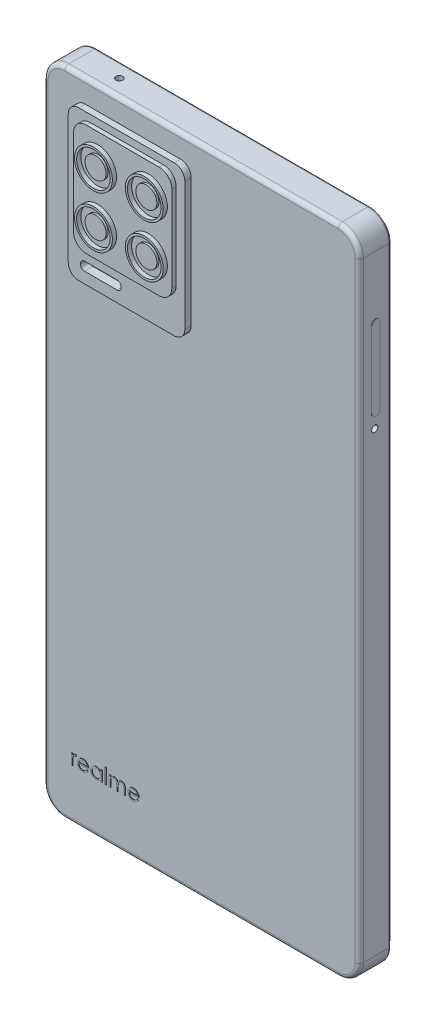
from build123d import *

# Parameters (mm, degrees)
BOSS_EXTRUDE1_DEPTH  = 7.5
BOSS_EXTRUDE3_DEPTH  = 1.5
BOSS_EXTRUDE5_DEPTH  = 1
CUT_EXTRUDE4_DEPTH   = 2
FILLET4_R            = 1
FILLET5_R            = 0.5
SKETCH5_R            = 4.5
SKETCH5_R_2          = 4
BOSS_EXTRUDE7_DEPTH  = 1
SKETCH6_R            = 2.5
BOSS_EXTRUDE8_DEPTH  = 0.5
BOSS_EXTRUDE10_DEPTH = 0.75
SKETCH8_R            = 2.5
CUT_EXTRUDE5_DEPTH   = 1
SKETCH9_R            = 1.8
BOSS_EXTRUDE11_DEPTH = 0.5
BOSS_EXTRUDE16_DEPTH = 0.75
SKETCH12_R           = 0.8
CUT_EXTRUDE7_DEPTH   = 8
CUT_EXTRUDE8_DEPTH   = 8
SKETCH15_W           = 7.919618757
SKETCH15_H           = 0.268242661
BOSS_EXTRUDE19_DEPTH = 7
SKETCH16_R           = 2
CUT_EXTRUDE9_DEPTH   = 7
SKETCH17_R           = 1
CUT_EXTRUDE10_DEPTH  = 7
CUT_EXTRUDE13_DEPTH  = 0.1
BOSS_EXTRUDE20_DEPTH = 0.1
SKETCH20_W           = 0.314102564
SKETCH20_H           = 3.58974359
BOSS_EXTRUDE21_DEPTH = 0.1
BOSS_EXTRUDE23_DEPTH = 0.05
SKETCH22_R           = 0.75
CUT_EXTRUDE15_DEPTH  = 7


with BuildPart() as part:
    # Sketch1 → Boss-Extrude1 (new body)
    with BuildSketch(Plane.XY):
        with BuildLine():
            Line((-14.166666667, 62.083333333), (50.833333333, 62.083333333))
            ThreePointArc((50.833333333, 62.083333333), (54.368867239, 60.618867239), (55.833333333, 57.083333333))
            Line((55.833333333, 57.083333333), (55.833333333, -87.916666667))
            ThreePointArc((55.833333333, -87.916666667), (54.368867239, -91.452200573), (50.833333333, -92.916666667))
            Line((50.833333333, -92.916666667), (-14.166666667, -92.916666667))
            ThreePointArc((-14.166666667, -92.916666667), (-17.702200573, -91.452200573), (-19.166666667, -87.916666667))
            Line((-19.166666667, -87.916666667), (-19.166666667, 57.083333333))
            ThreePointArc((-19.166666667, 57.083333333), (-17.702200573, 60.618867239), (-14.166666667, 62.083333333))
        make_face()
    extrude(amount=BOSS_EXTRUDE1_DEPTH)

    # Sketch2 → Boss-Extrude3 (add)
    with BuildSketch(Plane.XY.offset(7.5)):
        with BuildLine():
            Line((-9.342225207, 56.683333333), (13.357774793, 56.683333333))
            ThreePointArc((13.357774793, 56.683333333), (15.125541746, 55.951100286), (15.857774793, 54.183333333))
            Line((15.857774793, 54.183333333), (15.857774793, 23.583333333))
            ThreePointArc((15.857774793, 23.583333333), (15.125541746, 21.81556638), (13.357774793, 21.083333333))
            Line((13.357774793, 21.083333333), (-9.342225207, 21.083333333))
            ThreePointArc((-9.342225207, 21.083333333), (-11.10999216, 21.81556638), (-11.842225207, 23.583333333))
            Line((-11.842225207, 23.583333333), (-11.842225207, 54.183333333))
            ThreePointArc((-11.842225207, 54.183333333), (-11.10999216, 55.951100286), (-9.342225207, 56.683333333))
        make_face()
    extrude(amount=BOSS_EXTRUDE3_DEPTH)

    # Sketch3 → Boss-Extrude5 (add)
    with BuildSketch(Plane.XY.offset(9)):
        with BuildLine():
            Line((-6.575548555, 55.004495558), (10.774303424, 55.004495558))
            ThreePointArc((10.774303424, 55.004495558), (12.895623768, 54.125815902), (13.774303424, 52.004495558))
            Line((13.774303424, 52.004495558), (13.774303424, 31.53587849))
            ThreePointArc((13.774303424, 31.53587849), (12.895623768, 29.414558146), (10.774303424, 28.53587849))
            Line((10.774303424, 28.53587849), (-6.575548555, 28.53587849))
            ThreePointArc((-6.575548555, 28.53587849), (-8.696868898, 29.414558146), (-9.575548555, 31.53587849))
            Line((-9.575548555, 31.53587849), (-9.575548555, 52.004495558))
            ThreePointArc((-9.575548555, 52.004495558), (-8.696868898, 54.125815902), (-6.575548555, 55.004495558))
        make_face()
    extrude(amount=BOSS_EXTRUDE5_DEPTH)

    # Sketch4 → Cut-Extrude4 (cut)
    with BuildSketch(Plane.XY.offset(9)):
        with BuildLine():
            Line((-7.942225207, 25.781720126), (-0.24287533, 25.781720126))
            ThreePointArc((-0.24287533, 25.781720126), (0.464231451, 25.488826907), (0.75712467, 24.781720126))
            Line((0.75712467, 24.781720126), (0.75712467, 24.72141174))
            ThreePointArc((0.75712467, 24.72141174), (0.464231451, 24.014304959), (-0.24287533, 23.72141174))
            Line((-0.24287533, 23.72141174), (-7.942225207, 23.72141174))
            ThreePointArc((-7.942225207, 23.72141174), (-8.649331988, 24.014304959), (-8.942225207, 24.72141174))
            Line((-8.942225207, 24.72141174), (-8.942225207, 24.781720126))
            ThreePointArc((-8.942225207, 24.781720126), (-8.649331988, 25.488826907), (-7.942225207, 25.781720126))
        make_face()
    extrude(amount=-CUT_EXTRUDE4_DEPTH, mode=Mode.SUBTRACT)

    # Fillet4
    fillet4_edges = [part.edges().sort_by_distance(p)[0] for p in [
        (54.368867239, 60.618867239, 7.5),
        (18.333333333, 62.083333333, 7.5),
        (-17.702200573, 60.618867239, 7.5),
        (-19.166666667, -15.416666667, 7.5),
        (-17.702200573, -91.452200573, 7.5),
        (18.333333333, -92.916666667, 7.5),
        (54.368867239, -91.452200573, 7.5),
        (55.833333333, -15.416666667, 7.5),
    ]]
    fillet(fillet4_edges, radius=FILLET4_R)

    # Fillet5
    fillet5_edges = [part.edges().sort_by_distance(p)[0] for p in [
        (18.333333333, 62.083333333, 0),
        (54.368867239, 60.618867239, 0),
        (55.833333333, -15.416666667, 0),
        (54.368867239, -91.452200573, 0),
        (18.333333333, -92.916666667, 0),
        (-17.702200573, -91.452200573, 0),
        (-19.166666667, -15.416666667, 0),
        (-17.702200573, 60.618867239, 0),
    ]]
    fillet(fillet5_edges, radius=FILLET5_R)

    # Sketch5 → Boss-Extrude7 (add)
    # profile 1 of 4: a face of its own
    with BuildSketch(Plane.XY.offset(10)):
        with Locations((-3.85192843, 47.839398454)):
            Circle(SKETCH5_R)
        with Locations((-3.85192843, 47.839398454)):
            Circle(SKETCH5_R_2, mode=Mode.SUBTRACT)
    # profile 2 of 4: a face of its own
    with BuildSketch(Plane.XY.offset(10)):
        with Locations((-3.85192843, 35.581337572)):
            Circle(SKETCH5_R)
        with Locations((-3.85192843, 35.581337572)):
            Circle(SKETCH5_R_2, mode=Mode.SUBTRACT)
    # profile 3 of 4: a face of its own
    with BuildSketch(Plane.XY.offset(10)):
        with Locations((8.221534858, 35.581337572)):
            Circle(SKETCH5_R)
        with Locations((8.221534858, 35.581337572)):
            Circle(SKETCH5_R_2, mode=Mode.SUBTRACT)
    # profile 4 of 4: a face of its own
    with BuildSketch(Plane.XY.offset(10)):
        with Locations((8.221534858, 47.839398454)):
            Circle(SKETCH5_R)
        with Locations((8.221534858, 47.839398454)):
            Circle(SKETCH5_R_2, mode=Mode.SUBTRACT)
    extrude(amount=BOSS_EXTRUDE7_DEPTH)

    # Sketch6 → Boss-Extrude8 (add)
    with BuildSketch(Plane.XY.offset(10)):
        with Locations((-3.85192843, 47.839398454)):
            Circle(SKETCH6_R)
        with Locations((-3.85192843, 35.581337572)):
            Circle(SKETCH6_R)
        with Locations((8.221534858, 35.581337572)):
            Circle(SKETCH6_R)
        with Locations((8.221534858, 47.839398454)):
            Circle(SKETCH6_R)
    extrude(amount=BOSS_EXTRUDE8_DEPTH)

    # Sketch7 → Boss-Extrude10 (add)
    with BuildSketch(Plane(origin=(0, 0, 0), x_dir=(-1, 0, 0), z_dir=(0, 0, -1))):
        with BuildLine():
            Line((-50.833333333, 60.583333333), (14.166666667, 60.583333333))
            ThreePointArc((14.166666667, 60.583333333), (16.995093791, 59.411760458), (18.166666667, 56.583333333))
            Line((18.166666667, 56.583333333), (18.166666667, -87.416666667))
            ThreePointArc((18.166666667, -87.416666667), (16.995093791, -90.245093791), (14.166666667, -91.416666667))
            Line((14.166666667, -91.416666667), (-50.833333333, -91.416666667))
            ThreePointArc((-50.833333333, -91.416666667), (-53.661760458, -90.245093791), (-54.833333333, -87.416666667))
            Line((-54.833333333, -87.416666667), (-54.833333333, 56.583333333))
            ThreePointArc((-54.833333333, 56.583333333), (-53.661760458, 59.411760458), (-50.833333333, 60.583333333))
        make_face()
    extrude(amount=BOSS_EXTRUDE10_DEPTH)

    # Sketch8 → Cut-Extrude5 (cut)
    with BuildSketch(Plane(origin=(0, 0, -0.75), x_dir=(-1, 0, 0), z_dir=(0, 0, -1))):
        with Locations((-50.083333333, 55.618855431)):
            Circle(SKETCH8_R)
    extrude(amount=-CUT_EXTRUDE5_DEPTH, mode=Mode.SUBTRACT)

    # Sketch9 → Boss-Extrude11 (add)
    with BuildSketch(Plane(origin=(0, 0, 0.25), x_dir=(-1, 0, 0), z_dir=(0, 0, -1))):
        with Locations((-50.083333333, 55.618855431)):
            Circle(SKETCH9_R)
    extrude(amount=BOSS_EXTRUDE11_DEPTH)

    # Sketch10 → Boss-Extrude16 (add)
    with BuildSketch(Plane.ZY.offset(19.166666667)):
        with BuildLine():
            Line((4.896629232, 20.083333333), (4.896629232, 0.083333333))
            ThreePointArc((4.896629232, 0.083333333), (3.679261729, -1.13403417), (2.461894226, 0.083333333))
            Line((2.461894226, 0.083333333), (2.461894226, 20.083333333))
            ThreePointArc((2.461894226, 20.083333333), (3.679261729, 21.300700836), (4.896629232, 20.083333333))
        make_face()
        with BuildLine():
            Line((5.021365114, -8.167632772), (5.021365114, -19.167632772))
            ThreePointArc((5.021365114, -19.167632772), (3.679261729, -20.509736157), (2.337158343, -19.167632772))
            Line((2.337158343, -19.167632772), (2.337158343, -8.167632772))
            ThreePointArc((2.337158343, -8.167632772), (3.679261729, -6.825529387), (5.021365114, -8.167632772))
        make_face()
    extrude(amount=BOSS_EXTRUDE16_DEPTH)

    # Sketch12 → Cut-Extrude7 (cut)
    with BuildSketch(Plane(origin=(0, 62.083333333, 0), x_dir=(1, 0, 0), z_dir=(0, 1, 0))):
        with Locations(Location((-5.18973606, -3.5, 0), (0, 0, 270))):
            Circle(SKETCH12_R)
    extrude(amount=-CUT_EXTRUDE7_DEPTH, mode=Mode.SUBTRACT)

    # Sketch13 → Cut-Extrude8 (cut)
    with BuildSketch(Plane.XZ.offset(92.916666667)):
        with BuildLine():
            Line((15.333333333, 4.796928262), (24.333333333, 4.796928262))
            ThreePointArc((24.333333333, 4.796928262), (25.770853159, 3.359408436), (24.333333333, 1.92188861))
            Line((24.333333333, 1.92188861), (15.333333333, 1.92188861))
            ThreePointArc((15.333333333, 1.92188861), (13.895813507, 3.359408436), (15.333333333, 4.796928262))
        make_face()
    extrude(amount=-CUT_EXTRUDE8_DEPTH, mode=Mode.SUBTRACT)

    # Sketch15 → Boss-Extrude19 (add)
    with BuildSketch(Plane(origin=(0, -84.916666667, 0), x_dir=(-1, 0, 0), z_dir=(0, -1, 0))):
        with Locations((-19.830198847, -3.057664973)):
            Rectangle(SKETCH15_W, SKETCH15_H)
    extrude(amount=BOSS_EXTRUDE19_DEPTH)

    # Sketch16 → Cut-Extrude9 (cut)
    with BuildSketch(Plane(origin=(0, -92.916666667, 0), x_dir=(-1, 0, 0), z_dir=(0, -1, 0))):
        with Locations(Location((-45.899249036, -3.305574032, 0), (0, 0, 180))):
            Circle(SKETCH16_R)
    extrude(amount=-CUT_EXTRUDE9_DEPTH, mode=Mode.SUBTRACT)

    # Sketch17 → Cut-Extrude10 (cut)
    with BuildSketch(Plane.XZ.offset(92.916666667)):
        with Locations((-11.270024957, 3.533806432)):
            Circle(SKETCH17_R)
        with Locations((-8.270024957, 3.533806432)):
            Circle(SKETCH17_R)
        with Locations((-5.270024957, 3.533806432)):
            Circle(SKETCH17_R)
        with Locations((-2.270024957, 3.533806432)):
            Circle(SKETCH17_R)
        with Locations((0.729975043, 3.533806432)):
            Circle(SKETCH17_R)
        with Locations((31.85454908, 3.533806432)):
            Circle(SKETCH17_R)
        with Locations((34.85454908, 3.533806432)):
            Circle(SKETCH17_R)
    extrude(amount=-CUT_EXTRUDE10_DEPTH, mode=Mode.SUBTRACT)

    # Sketch18 → Cut-Extrude13 (cut)
    with BuildSketch(Plane(origin=(0, 0, -0.75), x_dir=(-1, 0, 0), z_dir=(0, 0, -1))):
        with BuildLine():
            Line((-27.833333333, 62.583333333), (-9.833333333, 62.583333333))
            ThreePointArc((-9.833333333, 62.583333333), (-7.833333333, 60.583333333), (-9.833333333, 58.583333333))
            Line((-9.833333333, 58.583333333), (-27.833333333, 58.583333333))
            ThreePointArc((-27.833333333, 58.583333333), (-29.833333333, 60.583333333), (-27.833333333, 62.583333333))
        make_face()
    extrude(amount=-CUT_EXTRUDE13_DEPTH, mode=Mode.SUBTRACT)

    # Sketch19 → Boss-Extrude20 (add)
    with BuildSketch(Plane(origin=(0, 0, -0.65), x_dir=(-1, 0, 0), z_dir=(0, 0, -1))):
        with BuildLine():
            Line((-27.652037886, 59.565095544), (-9.435764329, 59.565095544))
            ThreePointArc((-9.435764329, 59.565095544), (-9.365053651, 59.535806222), (-9.335764329, 59.465095544))
            Line((-9.335764329, 59.465095544), (-9.335764329, 59.269119771))
            ThreePointArc((-9.335764329, 59.269119771), (-9.365053651, 59.198409093), (-9.435764329, 59.169119771))
            Line((-9.435764329, 59.169119771), (-27.652037886, 59.169119771))
            ThreePointArc((-27.652037886, 59.169119771), (-27.722748564, 59.198409093), (-27.752037886, 59.269119771))
            Line((-27.752037886, 59.269119771), (-27.752037886, 59.465095544))
            ThreePointArc((-27.752037886, 59.465095544), (-27.722748564, 59.535806222), (-27.652037886, 59.565095544))
        make_face()
    extrude(amount=BOSS_EXTRUDE20_DEPTH)

    # Sketch20 → Boss-Extrude21 (add)
    # profile 1 of 6: a face of its own
    with BuildSketch(Plane.XY.offset(7.5)):
        with BuildLine():
            Line((-12.515569092, -78.364452134), (-12.201466528, -78.364452134))
            Line((-12.201466528, -78.364452134), (-12.201466528, -78.740954538))
            add(Edge.make_bspline(
                [(-12.201466528, -78.740954538), (-12.178277769, -78.70589871), (-12.133929448, -78.638854711), (-12.060216519, -78.55018541), (-11.984713188, -78.476770363), (-11.907058, -78.418266844), (-11.8266799, -78.374453725), (-11.745342949, -78.34236069), (-11.661767479, -78.323383375), (-11.605605555, -78.320849716), (-11.577468131, -78.31958034)],
                knots=[0, 0, 0, 0, 1.2804753, 2.448899062, 3.506932113, 4.484331642, 5.4025378, 6.288909075, 7.142734305, 8, 8, 8, 8], degree=3))
            add(Edge.make_bspline(
                [(-11.577468131, -78.31958034), (-11.555641804, -78.320770866), (-11.510732719, -78.323220452), (-11.442750129, -78.340431277), (-11.372706677, -78.367909299), (-11.32756429, -78.393749522), (-11.304030631, -78.407220564)],
                knots=[0, 0, 0, 0, 0.901110191, 1.854092781, 2.881294221, 4, 4, 4, 4], degree=3))
            Line((-11.304030631, -78.407220564), (-11.476506592, -78.67925582))
            add(Edge.make_bspline(
                [(-11.476506592, -78.67925582), (-11.491615613, -78.672515554), (-11.520295428, -78.659721239), (-11.562249994, -78.644579229), (-11.600931331, -78.635663313), (-11.625574889, -78.634312595), (-11.637063483, -78.633682904)],
                knots=[0, 0, 0, 0, 1.180555205, 2.24091978, 3.179933427, 4, 4, 4, 4], degree=3))
            add(Edge.make_bspline(
                [(-11.637063483, -78.633682904), (-11.662269217, -78.635362941), (-11.713681607, -78.63878973), (-11.789166106, -78.665728538), (-11.862413311, -78.709253778), (-11.920584974, -78.75752489), (-11.965627227, -78.804072687), (-11.997767452, -78.84472109), (-12.027250199, -78.890299722), (-12.05542042, -78.940029405), (-12.081086714, -78.994759251), (-12.105041383, -79.053942465), (-12.126700246, -79.117647594), (-12.13905049, -79.162030114), (-12.145376784, -79.184764634)],
                knots=[0, 0, 0, 0, 1.125678352, 2.296057538, 3.5422874, 4.923748041, 5.663163013, 6.437101912, 7.23742474, 8.08941207, 8.991984279, 9.93940061, 10.944477711, 12, 12, 12, 12], degree=3))
            add(Edge.make_bspline(
                [(-12.145376784, -79.184764634), (-12.150109178, -79.205041808), (-12.160591069, -79.249954207), (-12.170782607, -79.325302731), (-12.180852125, -79.41432639), (-12.187948744, -79.517272983), (-12.194526786, -79.633885427), (-12.198236868, -79.764341373), (-12.201340009, -79.908774724), (-12.201423075, -80.009749077), (-12.201466528, -80.062569122)],
                knots=[0, 0, 0, 0, 0.566838948, 1.255505196, 2.06880316, 3.007127437, 4.065329342, 5.249902469, 6.561414163, 8, 8, 8, 8], degree=3))
            Line((-12.201466528, -80.062569122), (-12.201466528, -80.922144442))
            Line((-12.201466528, -80.922144442), (-12.515569092, -80.922144442))
            Line((-12.515569092, -80.922144442), (-12.515569092, -78.364452134))
        make_face()
    # profile 2 of 6: a face of its own
    with BuildSketch(Plane.XY.offset(7.5)):
        with BuildLine():
            Line((-8.890769413, -80.114452134), (-8.611722938, -80.26098659))
            add(Edge.make_bspline(
                [(-8.611722938, -80.26098659), (-8.633959533, -80.300429921), (-8.677223142, -80.377171024), (-8.75162389, -80.482602884), (-8.829615962, -80.5774506), (-8.91471993, -80.659180254), (-9.004389609, -80.730431639), (-9.099122264, -80.792769464), (-9.199411082, -80.845887984), (-9.305260807, -80.890640512), (-9.417560358, -80.925050006), (-9.536581874, -80.949354227), (-9.66255337, -80.964377496), (-9.748899549, -80.966122637), (-9.793113163, -80.967016237)],
                knots=[0, 0, 0, 0, 1.120438281, 2.179929193, 3.190490725, 4.156257408, 5.095198341, 6.022838206, 6.959905092, 7.901321166, 8.864066838, 9.862729781, 10.905609505, 12, 12, 12, 12], degree=3))
            add(Edge.make_bspline(
                [(-9.793113163, -80.967016237), (-9.84225514, -80.965869062), (-9.938116902, -80.963631255), (-10.077656649, -80.94433879), (-10.209036067, -80.912866432), (-10.332247771, -80.86890089), (-10.446990023, -80.811473566), (-10.553490878, -80.741514084), (-10.652310404, -80.65938183), (-10.740334613, -80.564365386), (-10.819578496, -80.462683429), (-10.889504316, -80.356727544), (-10.947961747, -80.24676432), (-10.995514357, -80.133493796), (-11.033919222, -80.017629902), (-11.060685926, -79.898118435), (-11.076115674, -79.775282851), (-11.078480119, -79.692185515), (-11.079671656, -79.650309506)],
                knots=[0, 0, 0, 0, 1.145258523, 2.234067595, 3.276747158, 4.290159414, 5.277019952, 6.260822364, 7.254936242, 8.264827045, 9.274100331, 10.257902744, 11.220704747, 12.172965371, 13.118907548, 14.062713208, 15.023725156, 16, 16, 16, 16], degree=3))
            add(Edge.make_bspline(
                [(-11.079671656, -79.650309506), (-11.078612515, -79.611014676), (-11.076513437, -79.533137511), (-11.063282649, -79.417871967), (-11.039834356, -79.305843514), (-11.007658032, -79.196959066), (-10.966106786, -79.091400932), (-10.915274567, -78.989104868), (-10.855082189, -78.890179729), (-10.808609515, -78.827776595), (-10.785200502, -78.79634316)],
                knots=[0, 0, 0, 0, 1.024358464, 2.0301432, 3.019427413, 4.004406732, 4.986367066, 5.972626655, 6.978780325, 8, 8, 8, 8], degree=3))
            add(Edge.make_bspline(
                [(-10.785200502, -78.79634316), (-10.75349282, -78.75847429), (-10.691081873, -78.68393614), (-10.585525518, -78.585997814), (-10.471225321, -78.503954039), (-10.349613695, -78.435946902), (-10.219277221, -78.384273255), (-10.08196793, -78.345765673), (-9.936122344, -78.324187662), (-9.836417123, -78.321139829), (-9.785400823, -78.31958034)],
                knots=[0, 0, 0, 0, 1.030682036, 2.02871468, 2.997146059, 3.962720338, 4.930598197, 5.918074684, 6.934738563, 8, 8, 8, 8], degree=3))
            add(Edge.make_bspline(
                [(-9.785400823, -78.31958034), (-9.732953218, -78.320934388), (-9.630062972, -78.323590724), (-9.480030851, -78.348217057), (-9.338070134, -78.387269612), (-9.20423763, -78.442423402), (-9.078519769, -78.513582954), (-8.961733719, -78.601724795), (-8.851882207, -78.704142883), (-8.787973628, -78.782906092), (-8.755452906, -78.822985788)],
                knots=[0, 0, 0, 0, 1.056321875, 2.072262726, 3.055038591, 4.01806755, 4.982017516, 5.957941055, 6.960871419, 8, 8, 8, 8], degree=3))
            add(Edge.make_bspline(
                [(-8.755452906, -78.822985788), (-8.733325968, -78.85318937), (-8.689219375, -78.913395488), (-8.633972275, -79.011566645), (-8.58601488, -79.11427724), (-8.547681919, -79.223187537), (-8.516642418, -79.337007117), (-8.494185599, -79.456549662), (-8.48101598, -79.581779573), (-8.478427283, -79.667106129), (-8.477107554, -79.710605981)],
                knots=[0, 0, 0, 0, 0.94817472, 1.890038105, 2.849395472, 3.817997239, 4.812318967, 5.836947057, 6.897266129, 8, 8, 8, 8], degree=3))
            Line((-8.477107554, -79.710605981), (-10.765569092, -79.710605981))
            add(Edge.make_bspline(
                [(-10.765569092, -79.710605981), (-10.764029486, -79.744306445), (-10.761001912, -79.810577049), (-10.746886769, -79.907547832), (-10.724637995, -79.999921174), (-10.693368932, -80.087004216), (-10.655502087, -80.169934343), (-10.60911637, -80.24809638), (-10.553776816, -80.32113431), (-10.492051117, -80.389701448), (-10.423344021, -80.450762209), (-10.351061274, -80.505413985), (-10.274167709, -80.551219582), (-10.193269626, -80.588399472), (-10.108497841, -80.617505788), (-10.019825645, -80.637373609), (-9.927427529, -80.650680715), (-9.864441795, -80.652160381), (-9.832375983, -80.652913673)],
                knots=[0, 0, 0, 0, 1.094153842, 2.151609401, 3.174256925, 4.172055639, 5.149267565, 6.128595816, 7.11444997, 8.118368179, 9.117203808, 10.09244225, 11.054858984, 12.015122123, 12.976791628, 13.957293641, 14.960065497, 16, 16, 16, 16], degree=3))
            add(Edge.make_bspline(
                [(-9.832375983, -80.652913673), (-9.801024835, -80.652305616), (-9.738818145, -80.651099115), (-9.646177287, -80.639367204), (-9.55503776, -80.620396929), (-9.465776777, -80.594506939), (-9.380205931, -80.562930086), (-9.300960381, -80.524827229), (-9.228080165, -80.482677482), (-9.159963198, -80.434467807), (-9.093892205, -80.37545962), (-9.028349719, -80.301823899), (-8.958073065, -80.214736371), (-8.914083472, -80.149190705), (-8.890769413, -80.114452134)],
                knots=[0, 0, 0, 0, 0.99110716, 1.966546729, 2.947904876, 3.932708344, 4.903319531, 5.828989031, 6.710028674, 7.56322171, 8.463672341, 9.504779593, 10.677557249, 12, 12, 12, 12], degree=3))
        make_face()
        with BuildLine():
            add(Edge.make_bspline(
                [(-8.791210118, -79.396503416), (-8.802706742, -79.354840543), (-8.824834044, -79.274652922), (-8.871070408, -79.163612032), (-8.923141949, -79.064924131), (-8.98476368, -78.979344498), (-9.054582406, -78.903340985), (-9.135227589, -78.836922399), (-9.225663482, -78.777504948), (-9.325422623, -78.727352449), (-9.431064408, -78.68466259), (-9.5416706, -78.656037474), (-9.654528388, -78.636427932), (-9.730862674, -78.634601824), (-9.769275022, -78.633682904)],
                knots=[0, 0, 0, 0, 1.154881502, 2.222775134, 3.210006277, 4.132804581, 5.035138423, 5.962687519, 6.919655026, 7.923214229, 8.944639381, 9.960483929, 10.97369054, 12, 12, 12, 12], degree=3))
            add(Edge.make_bspline(
                [(-9.769275022, -78.633682904), (-9.80062446, -78.634294575), (-9.862595709, -78.635503721), (-9.953896777, -78.646973851), (-10.041576476, -78.665933695), (-10.126281764, -78.691898652), (-10.206902632, -78.726507255), (-10.2850974, -78.767090481), (-10.358877797, -78.816632065), (-10.405019092, -78.85439092), (-10.428329509, -78.873466557)],
                knots=[0, 0, 0, 0, 1.04873581, 2.073130211, 3.073294108, 4.04793562, 5.032784715, 6.005352987, 6.992311501, 8, 8, 8, 8], degree=3))
            add(Edge.make_bspline(
                [(-10.428329509, -78.873466557), (-10.445022791, -78.888560873), (-10.478805925, -78.919108089), (-10.523946446, -78.971737296), (-10.567166919, -79.028488858), (-10.606500572, -79.091533982), (-10.642578158, -79.160154761), (-10.676338135, -79.233772397), (-10.706724548, -79.312945527), (-10.723820658, -79.368117966), (-10.732616368, -79.396503416)],
                knots=[0, 0, 0, 0, 0.879870761, 1.780643979, 2.707998968, 3.669668524, 4.684282772, 5.740141944, 6.837334558, 8, 8, 8, 8], degree=3))
            Line((-10.732616368, -79.396503416), (-8.791210118, -79.396503416))
        make_face(mode=Mode.SUBTRACT)
    # profile 3 of 6: a face of its own
    with BuildSketch(Plane.XY.offset(7.5)):
        with BuildLine():
            Line((-5.246338323, -78.364452134), (-5.246338323, -80.922144442))
            Line((-5.246338323, -80.922144442), (-5.560440887, -80.922144442))
            Line((-5.560440887, -80.922144442), (-5.560440887, -80.47973659))
            add(Edge.make_bspline(
                [(-5.560440887, -80.47973659), (-5.595859678, -80.519776183), (-5.664979893, -80.597913955), (-5.780421011, -80.699996127), (-5.902789189, -80.784374449), (-6.03149051, -80.852524364), (-6.166408753, -80.903716421), (-6.30724484, -80.94010258), (-6.454056221, -80.963496415), (-6.554308576, -80.965832437), (-6.605112361, -80.967016237)],
                knots=[0, 0, 0, 0, 1.074387032, 2.096679803, 3.090159297, 4.057316773, 5.018401886, 5.985159533, 6.978961417, 8, 8, 8, 8], degree=3))
            add(Edge.make_bspline(
                [(-6.605112361, -80.967016237), (-6.650280315, -80.965789865), (-6.73935352, -80.963371404), (-6.870382597, -80.944609101), (-6.996474847, -80.914478479), (-7.117749419, -80.87257759), (-7.233421565, -80.816996768), (-7.344481661, -80.75045552), (-7.450354353, -80.67121469), (-7.549425892, -80.580626661), (-7.640657893, -80.482231674), (-7.720719165, -80.377286127), (-7.787472245, -80.266243823), (-7.843292326, -80.15051067), (-7.88628867, -80.02919575), (-7.916262305, -79.902718582), (-7.935002751, -79.771228709), (-7.937420212, -79.681689185), (-7.938646015, -79.63628707)],
                knots=[0, 0, 0, 0, 1.033919861, 2.038935746, 3.024066025, 3.998881131, 4.97069526, 5.957263378, 6.95902576, 7.993208707, 9.027059324, 10.027763471, 11.009749337, 11.988697705, 12.965288445, 13.950418724, 14.960734635, 16, 16, 16, 16], degree=3))
            add(Edge.make_bspline(
                [(-7.938646015, -79.63628707), (-7.937393044, -79.591823367), (-7.934915987, -79.503921023), (-7.916462767, -79.374642325), (-7.885431758, -79.250124065), (-7.841883911, -79.130767121), (-7.786041956, -79.016427071), (-7.718113869, -78.907023046), (-7.638094744, -78.802253649), (-7.545842337, -78.704582422), (-7.445907567, -78.614361808), (-7.338998836, -78.535952762), (-7.227775555, -78.468235913), (-7.110512544, -78.414582437), (-6.988945439, -78.371173333), (-6.861991994, -78.341140365), (-6.730180415, -78.323443043), (-6.640689923, -78.320880279), (-6.595296656, -78.31958034)],
                knots=[0, 0, 0, 0, 1.020392517, 2.01726096, 2.990465484, 3.961182959, 4.928053699, 5.906110375, 6.912531644, 7.948652711, 8.985773172, 9.998621852, 10.987621588, 11.969261332, 12.953316658, 13.946091881, 14.958173133, 16, 16, 16, 16], degree=3))
            add(Edge.make_bspline(
                [(-6.595296656, -78.31958034), (-6.543096797, -78.321018091), (-6.440735337, -78.323837454), (-6.291007328, -78.347300181), (-6.14936285, -78.386938648), (-6.014708498, -78.440856146), (-5.887527812, -78.512504876), (-5.769024828, -78.602884837), (-5.657959344, -78.711426024), (-5.593579053, -78.794796468), (-5.560440887, -78.837709346)],
                knots=[0, 0, 0, 0, 1.038897134, 2.037228247, 3.008116434, 3.962042015, 4.918381754, 5.904844433, 6.921570401, 8, 8, 8, 8], degree=3))
            Line((-5.560440887, -78.837709346), (-5.560440887, -78.364452134))
            Line((-5.560440887, -78.364452134), (-5.246338323, -78.364452134))
        make_face()
        with BuildLine():
            add(Edge.make_bspline(
                [(-6.591089925, -78.633682904), (-6.637004263, -78.635316541), (-6.727631863, -78.638541082), (-6.860675865, -78.663714578), (-6.987989279, -78.705599172), (-7.108935354, -78.762881073), (-7.22160357, -78.83490981), (-7.322297241, -78.922031193), (-7.411839942, -79.021868207), (-7.487148207, -79.133970318), (-7.548538704, -79.254148409), (-7.591705736, -79.379772847), (-7.620174983, -79.508577824), (-7.623083504, -79.59594051), (-7.624543451, -79.639792679)],
                knots=[0, 0, 0, 0, 1.031046209, 2.035121221, 3.029706178, 4.034933723, 5.034054252, 6.02443088, 7.017295772, 8.038157696, 9.050218397, 10.03989886, 11.016116709, 12, 12, 12, 12], degree=3))
            add(Edge.make_bspline(
                [(-7.624543451, -79.639792679), (-7.622678558, -79.683382786), (-7.618956081, -79.770392142), (-7.592205386, -79.899372719), (-7.547325513, -80.025026761), (-7.48608345, -80.146287755), (-7.409396826, -80.258871855), (-7.320508173, -80.360611978), (-7.218557892, -80.448101566), (-7.105630385, -80.521339139), (-6.985022414, -80.58050166), (-6.858188483, -80.6216673), (-6.727512845, -80.64824508), (-6.638660511, -80.651349557), (-6.593894413, -80.652913673)],
                knots=[0, 0, 0, 0, 0.979072187, 1.954306742, 2.945804271, 3.96968567, 4.997920485, 5.998718438, 6.996577872, 8.005894225, 9.015743152, 10.005417472, 10.995077863, 12, 12, 12, 12], degree=3))
            add(Edge.make_bspline(
                [(-6.593894413, -80.652913673), (-6.54844791, -80.651253709), (-6.458059323, -80.647952205), (-6.324620615, -80.62267094), (-6.195125653, -80.580902142), (-6.071338424, -80.523003015), (-5.956022293, -80.451245659), (-5.852524415, -80.367238568), (-5.765008447, -80.269535384), (-5.690815838, -80.162158931), (-5.632640421, -80.044446934), (-5.590264362, -79.919112744), (-5.565210456, -79.786151996), (-5.562052726, -79.695288069), (-5.560440887, -79.648907263)],
                knots=[0, 0, 0, 0, 1.01762866, 2.023962475, 3.030623092, 4.058876274, 5.077231937, 6.066672613, 7.034107872, 8.005628644, 8.981990164, 9.965428785, 10.961468474, 12, 12, 12, 12], degree=3))
            add(Edge.make_bspline(
                [(-5.560440887, -79.648907263), (-5.561400543, -79.613569432), (-5.563289451, -79.544013399), (-5.57772002, -79.441885881), (-5.600674947, -79.344152155), (-5.633021117, -79.250709466), (-5.675512401, -79.162074451), (-5.726760167, -79.07761069), (-5.787665617, -78.997757479), (-5.857248313, -78.923614408), (-5.933413515, -78.855987946), (-6.014008056, -78.795623705), (-6.099986803, -78.746034932), (-6.18990384, -78.704993661), (-6.283915174, -78.672334511), (-6.382785794, -78.650546817), (-6.485464781, -78.635586496), (-6.555510836, -78.634324115), (-6.591089925, -78.633682904)],
                knots=[0, 0, 0, 0, 1.050140795, 2.067009409, 3.05949893, 4.030605086, 5.00011959, 5.97591094, 6.962425594, 7.979863591, 8.993523472, 9.986985069, 10.967611495, 11.937549037, 12.921786183, 13.919465291, 14.943216303, 16, 16, 16, 16], degree=3))
        make_face(mode=Mode.SUBTRACT)
    # profile 4 of 6: a face of its own
    with BuildSketch(Plane.XY.offset(7.5)):
        with Locations((-4.416210118, -79.127272647)):
            Rectangle(SKETCH20_W, SKETCH20_H)
    # profile 5 of 6: a face of its own
    with BuildSketch(Plane.XY.offset(7.5)):
        with BuildLine():
            Line((-3.541210118, -78.364452134), (-3.227107554, -78.364452134))
            Line((-3.227107554, -78.364452134), (-3.227107554, -78.808963352))
            add(Edge.make_bspline(
                [(-3.227107554, -78.808963352), (-3.198823604, -78.770075751), (-3.144628844, -78.695563378), (-3.055763192, -78.597373093), (-2.966987079, -78.514044939), (-2.903053697, -78.470302067), (-2.872339925, -78.449287872)],
                knots=[0, 0, 0, 0, 1.134379233, 2.173579362, 3.122582517, 4, 4, 4, 4], degree=3))
            add(Edge.make_bspline(
                [(-2.872339925, -78.449287872), (-2.830475263, -78.429282506), (-2.747477363, -78.389621293), (-2.616058139, -78.349387734), (-2.481583469, -78.324662633), (-2.390775255, -78.321281259), (-2.345096336, -78.31958034)],
                knots=[0, 0, 0, 0, 1.014936303, 2.012140481, 3.000054389, 4, 4, 4, 4], degree=3))
            add(Edge.make_bspline(
                [(-2.345096336, -78.31958034), (-2.314203339, -78.32062563), (-2.25306776, -78.322694205), (-2.16248367, -78.33615424), (-2.074625058, -78.359420413), (-1.990011029, -78.391827737), (-1.91029035, -78.431074424), (-1.837201152, -78.477124132), (-1.771576944, -78.528821207), (-1.713450892, -78.58850014), (-1.661181867, -78.657836738), (-1.61310302, -78.738700987), (-1.568677808, -78.832908648), (-1.544056499, -78.901275189), (-1.531093932, -78.937268641)],
                knots=[0, 0, 0, 0, 1.009824226, 1.998387844, 2.986035974, 3.974953746, 4.955485308, 5.885931332, 6.793869504, 7.679848016, 8.601185859, 9.625726857, 10.749998409, 12, 12, 12, 12], degree=3))
            add(Edge.make_bspline(
                [(-1.531093932, -78.937268641), (-1.51738268, -78.912544222), (-1.490400863, -78.863890037), (-1.445095226, -78.795031774), (-1.39762743, -78.730624982), (-1.347592937, -78.670618558), (-1.29516835, -78.615308828), (-1.24010695, -78.564512926), (-1.182722168, -78.518012712), (-1.102929928, -78.463689553), (-0.999117321, -78.405988371), (-0.868229206, -78.355959927), (-0.732079035, -78.325043799), (-0.639661336, -78.321413526), (-0.59299297, -78.31958034)],
                knots=[0, 0, 0, 0, 0.86119277, 1.694706429, 2.50939023, 3.298075842, 4.073795165, 4.829715201, 5.57930267, 6.321991688, 7.768977793, 9.186738141, 10.579381044, 12, 12, 12, 12], degree=3))
            add(Edge.make_bspline(
                [(-0.59299297, -78.31958034), (-0.550111507, -78.32119756), (-0.466188321, -78.324362619), (-0.344011055, -78.349216092), (-0.23006925, -78.391893739), (-0.124592174, -78.450127376), (-0.029432361, -78.523306559), (0.053283949, -78.610375397), (0.123054312, -78.71071802), (0.168632952, -78.805110008), (0.199548216, -78.888445341), (0.21860945, -78.959451632), (0.235449145, -79.037603185), (0.249430391, -79.122993447), (0.259648943, -79.215924055), (0.267219658, -79.316242931), (0.272343732, -79.424028043), (0.272705804, -79.498393543), (0.272892446, -79.536727775)],
                knots=[0, 0, 0, 0, 1.209669288, 2.367440248, 3.500751976, 4.631527125, 5.755587489, 6.87532382, 8.007944318, 9.190864318, 9.82315674, 10.514484317, 11.263564316, 12.079023757, 12.955305781, 13.901327259, 14.918167583, 16, 16, 16, 16], degree=3))
            Line((0.272892446, -79.536727775), (0.272892446, -80.922144442))
            Line((0.272892446, -80.922144442), (-0.041210118, -80.922144442))
            Line((-0.041210118, -80.922144442), (-0.041210118, -79.535325532))
            add(Edge.make_bspline(
                [(-0.041210118, -79.535325532), (-0.041288001, -79.502604958), (-0.04143768, -79.439720991), (-0.044131311, -79.34946854), (-0.049206626, -79.267200183), (-0.055141264, -79.193028094), (-0.063385074, -79.126779306), (-0.074031005, -79.068586887), (-0.085308685, -79.017993076), (-0.104044676, -78.961907028), (-0.133992568, -78.900036818), (-0.179610048, -78.833313242), (-0.237080154, -78.775232442), (-0.303440311, -78.724814125), (-0.378988756, -78.683820484), (-0.462253479, -78.654544474), (-0.55271753, -78.636421596), (-0.615340319, -78.63461558), (-0.64768047, -78.633682904)],
                knots=[0, 0, 0, 0, 1.253487763, 2.409012846, 3.458416907, 4.410876679, 5.259312806, 6.014470957, 6.676830364, 7.243083969, 8.276244668, 9.299465089, 10.325150304, 11.392391894, 12.482080715, 13.603491619, 14.762376348, 16, 16, 16, 16], degree=3))
            add(Edge.make_bspline(
                [(-0.64768047, -78.633682904), (-0.687350425, -78.635099061), (-0.765753336, -78.637897926), (-0.880198822, -78.666471799), (-0.990169839, -78.70955205), (-1.092384972, -78.771984507), (-1.186412762, -78.846792871), (-1.26731234, -78.935742467), (-1.334144526, -79.036372394), (-1.379398502, -79.129519096), (-1.407987803, -79.21318854), (-1.426864719, -79.286285912), (-1.44154811, -79.36936748), (-1.455318639, -79.461874971), (-1.464306367, -79.564445151), (-1.47247474, -79.676603552), (-1.476295602, -79.798687511), (-1.476830061, -79.8833142), (-1.477107554, -79.927252615)],
                knots=[0, 0, 0, 0, 1.090531906, 2.155305635, 3.229839962, 4.33261226, 5.44038871, 6.529323825, 7.629011124, 8.757537029, 9.370236727, 10.061839251, 10.834451254, 11.692844982, 12.636905849, 13.66920014, 14.789842145, 16, 16, 16, 16], degree=3))
            Line((-1.477107554, -79.927252615), (-1.477107554, -80.922144442))
            Line((-1.477107554, -80.922144442), (-1.791210118, -80.922144442))
            Line((-1.791210118, -80.922144442), (-1.791210118, -79.621563513))
            add(Edge.make_bspline(
                [(-1.791210118, -79.621563513), (-1.791289549, -79.584870194), (-1.791442366, -79.514275937), (-1.794118683, -79.413042261), (-1.799205305, -79.320961181), (-1.805085853, -79.238139717), (-1.813546032, -79.164728389), (-1.823155794, -79.100333631), (-1.834504404, -79.04511688), (-1.853294289, -78.984553495), (-1.882008757, -78.917832572), (-1.928197019, -78.846691551), (-1.9858046, -78.784423453), (-2.053375476, -78.731264705), (-2.129381158, -78.687323223), (-2.213364559, -78.655663472), (-2.304569471, -78.637239182), (-2.367447177, -78.634890685), (-2.399783836, -78.633682904)],
                knots=[0, 0, 0, 0, 1.320475261, 2.540461679, 3.643808994, 4.639130445, 5.527981419, 6.302341397, 6.981980563, 7.553956391, 8.582137848, 9.585246428, 10.591171744, 11.620968678, 12.668337649, 13.738356861, 14.836885341, 16, 16, 16, 16], degree=3))
            add(Edge.make_bspline(
                [(-2.399783836, -78.633682904), (-2.437800047, -78.635213364), (-2.513565007, -78.638263516), (-2.624866976, -78.66571779), (-2.73235266, -78.708721865), (-2.834307359, -78.768381684), (-2.927981507, -78.842280762), (-3.009989774, -78.929195658), (-3.0789323, -79.028044692), (-3.124664115, -79.120209208), (-3.154162589, -79.201782483), (-3.173757923, -79.271133431), (-3.190597549, -79.348133679), (-3.203111571, -79.43302079), (-3.215191987, -79.525241884), (-3.221022296, -79.625256374), (-3.226693858, -79.732978462), (-3.226966272, -79.807351007), (-3.227107554, -79.845922487)],
                knots=[0, 0, 0, 0, 1.098833095, 2.189935336, 3.297829714, 4.440610912, 5.596351641, 6.740013378, 7.886572111, 9.072425424, 9.705826452, 10.395263256, 11.156850408, 11.985370555, 12.878090359, 13.847760091, 14.883794034, 16, 16, 16, 16], degree=3))
            Line((-3.227107554, -79.845922487), (-3.227107554, -80.922144442))
            Line((-3.227107554, -80.922144442), (-3.541210118, -80.922144442))
            Line((-3.541210118, -80.922144442), (-3.541210118, -78.364452134))
        make_face()
    # profile 6 of 6: a face of its own
    with BuildSketch(Plane.XY.offset(7.5)):
        with BuildLine():
            Line((3.089999818, -80.114452134), (3.369046293, -80.26098659))
            add(Edge.make_bspline(
                [(3.369046293, -80.26098659), (3.346809697, -80.300429921), (3.303546089, -80.377171024), (3.229145341, -80.482602884), (3.151153268, -80.5774506), (3.0660493, -80.659180254), (2.976379621, -80.730431639), (2.881646967, -80.792769464), (2.781358149, -80.845887984), (2.675508424, -80.890640512), (2.563208873, -80.925050006), (2.444187357, -80.949354227), (2.318215861, -80.964377496), (2.231869681, -80.966122637), (2.187656068, -80.967016237)],
                knots=[0, 0, 0, 0, 1.120438281, 2.179929193, 3.190490725, 4.156257408, 5.095198341, 6.022838206, 6.959905092, 7.901321166, 8.864066838, 9.862729781, 10.905609505, 12, 12, 12, 12], degree=3))
            add(Edge.make_bspline(
                [(2.187656068, -80.967016237), (2.138514091, -80.965869062), (2.042652329, -80.963631255), (1.903112582, -80.94433879), (1.771733163, -80.912866432), (1.64852146, -80.86890089), (1.533779208, -80.811473566), (1.427278353, -80.741514084), (1.328458827, -80.65938183), (1.240434618, -80.564365386), (1.161190735, -80.462683429), (1.091264915, -80.356727544), (1.032807484, -80.24676432), (0.985254874, -80.133493796), (0.946850009, -80.017629902), (0.920083305, -79.898118435), (0.904653557, -79.775282851), (0.902289112, -79.692185515), (0.901097575, -79.650309506)],
                knots=[0, 0, 0, 0, 1.145258523, 2.234067595, 3.276747158, 4.290159414, 5.277019952, 6.260822364, 7.254936242, 8.264827045, 9.274100331, 10.257902744, 11.220704747, 12.172965371, 13.118907548, 14.062713208, 15.023725156, 16, 16, 16, 16], degree=3))
            add(Edge.make_bspline(
                [(0.901097575, -79.650309506), (0.902156716, -79.611014676), (0.904255794, -79.533137511), (0.917486582, -79.417871967), (0.940934875, -79.305843514), (0.973111199, -79.196959066), (1.014662445, -79.091400932), (1.065494664, -78.989104868), (1.125687042, -78.890179729), (1.172159716, -78.827776595), (1.195568728, -78.79634316)],
                knots=[0, 0, 0, 0, 1.024358464, 2.0301432, 3.019427413, 4.004406732, 4.986367066, 5.972626655, 6.978780325, 8, 8, 8, 8], degree=3))
            add(Edge.make_bspline(
                [(1.195568728, -78.79634316), (1.227276411, -78.75847429), (1.289687358, -78.68393614), (1.395243713, -78.585997814), (1.50954391, -78.503954039), (1.631155536, -78.435946902), (1.76149201, -78.384273255), (1.898801301, -78.345765673), (2.044646887, -78.324187662), (2.144352108, -78.321139829), (2.195368408, -78.31958034)],
                knots=[0, 0, 0, 0, 1.030682036, 2.02871468, 2.997146059, 3.962720338, 4.930598197, 5.918074684, 6.934738563, 8, 8, 8, 8], degree=3))
            add(Edge.make_bspline(
                [(2.195368408, -78.31958034), (2.247816013, -78.320934388), (2.350706259, -78.323590724), (2.50073838, -78.348217057), (2.642699097, -78.387269612), (2.776531601, -78.442423402), (2.902249462, -78.513582954), (3.019035511, -78.601724795), (3.128887024, -78.704142883), (3.192795603, -78.782906092), (3.225316325, -78.822985788)],
                knots=[0, 0, 0, 0, 1.056321875, 2.072262726, 3.055038591, 4.01806755, 4.982017516, 5.957941055, 6.960871419, 8, 8, 8, 8], degree=3))
            add(Edge.make_bspline(
                [(3.225316325, -78.822985788), (3.247443263, -78.85318937), (3.291549856, -78.913395488), (3.346796956, -79.011566645), (3.394754351, -79.11427724), (3.433087312, -79.223187537), (3.464126813, -79.337007117), (3.486583632, -79.456549662), (3.499753251, -79.581779573), (3.502341948, -79.667106129), (3.503661677, -79.710605981)],
                knots=[0, 0, 0, 0, 0.94817472, 1.890038105, 2.849395472, 3.817997239, 4.812318967, 5.836947057, 6.897266129, 8, 8, 8, 8], degree=3))
            Line((3.503661677, -79.710605981), (1.215200139, -79.710605981))
            add(Edge.make_bspline(
                [(1.215200139, -79.710605981), (1.216739745, -79.744306445), (1.219767319, -79.810577049), (1.233882462, -79.907547832), (1.256131236, -79.999921174), (1.287400299, -80.087004216), (1.325267144, -80.169934343), (1.371652861, -80.24809638), (1.426992415, -80.32113431), (1.488718114, -80.389701448), (1.557425209, -80.450762209), (1.629707957, -80.505413985), (1.706601522, -80.551219582), (1.787499605, -80.588399472), (1.87227139, -80.617505788), (1.960943585, -80.637373609), (2.053341702, -80.650680715), (2.116327436, -80.652160381), (2.148393248, -80.652913673)],
                knots=[0, 0, 0, 0, 1.094153842, 2.151609401, 3.174256925, 4.172055639, 5.149267565, 6.128595816, 7.11444997, 8.118368179, 9.117203808, 10.09244225, 11.054858984, 12.015122123, 12.976791628, 13.957293641, 14.960065497, 16, 16, 16, 16], degree=3))
            add(Edge.make_bspline(
                [(2.148393248, -80.652913673), (2.179744395, -80.652305616), (2.241951086, -80.651099115), (2.334591944, -80.639367204), (2.425731471, -80.620396929), (2.514992454, -80.594506939), (2.6005633, -80.562930086), (2.67980885, -80.524827229), (2.752689066, -80.482677482), (2.820806032, -80.434467807), (2.886877026, -80.37545962), (2.952419512, -80.301823899), (3.022696166, -80.214736371), (3.066685758, -80.149190705), (3.089999818, -80.114452134)],
                knots=[0, 0, 0, 0, 0.99110716, 1.966546729, 2.947904876, 3.932708344, 4.903319531, 5.828989031, 6.710028674, 7.56322171, 8.463672341, 9.504779593, 10.677557249, 12, 12, 12, 12], degree=3))
        make_face()
        with BuildLine():
            add(Edge.make_bspline(
                [(3.189559113, -79.396503416), (3.178062489, -79.354840543), (3.155935187, -79.274652922), (3.109698823, -79.163612032), (3.057627282, -79.064924131), (2.996005551, -78.979344498), (2.926186825, -78.903340985), (2.845541642, -78.836922399), (2.755105749, -78.777504948), (2.655346608, -78.727352449), (2.549704823, -78.68466259), (2.439098631, -78.656037474), (2.326240843, -78.636427932), (2.249906557, -78.634601824), (2.211494209, -78.633682904)],
                knots=[0, 0, 0, 0, 1.154881502, 2.222775134, 3.210006277, 4.132804581, 5.035138423, 5.962687519, 6.919655026, 7.923214229, 8.944639381, 9.960483929, 10.97369054, 12, 12, 12, 12], degree=3))
            add(Edge.make_bspline(
                [(2.211494209, -78.633682904), (2.180144771, -78.634294575), (2.118173522, -78.635503721), (2.026872453, -78.646973851), (1.939192755, -78.665933695), (1.854487467, -78.691898652), (1.773866599, -78.726507255), (1.69567183, -78.767090481), (1.621891434, -78.816632065), (1.575750139, -78.85439092), (1.552439722, -78.873466557)],
                knots=[0, 0, 0, 0, 1.04873581, 2.073130211, 3.073294108, 4.04793562, 5.032784715, 6.005352987, 6.992311501, 8, 8, 8, 8], degree=3))
            add(Edge.make_bspline(
                [(1.552439722, -78.873466557), (1.53574644, -78.888560873), (1.501963306, -78.919108089), (1.456822784, -78.971737296), (1.413602312, -79.028488858), (1.374268659, -79.091533982), (1.338191072, -79.160154761), (1.304431095, -79.233772397), (1.274044683, -79.312945527), (1.256948573, -79.368117966), (1.248152863, -79.396503416)],
                knots=[0, 0, 0, 0, 0.879870761, 1.780643979, 2.707998968, 3.669668524, 4.684282772, 5.740141944, 6.837334558, 8, 8, 8, 8], degree=3))
            Line((1.248152863, -79.396503416), (3.189559113, -79.396503416))
        make_face(mode=Mode.SUBTRACT)
    extrude(amount=BOSS_EXTRUDE21_DEPTH)

    # Sketch21 → Boss-Extrude23 (add)
    with BuildSketch(Plane(origin=(55.833333333, 0, 0), x_dir=(0, 0, -1), z_dir=(1, 0, 0))):
        with BuildLine():
            Line((-2.581284163, 42.083333333), (-2.581284163, 24.083333333))
            ThreePointArc((-2.581284163, 24.083333333), (-3.590809257, 23.073808239), (-4.600334351, 24.083333333))
            Line((-4.600334351, 24.083333333), (-4.600334351, 42.083333333))
            ThreePointArc((-4.600334351, 42.083333333), (-3.590809257, 43.092858427), (-2.581284163, 42.083333333))
        make_face()
    extrude(amount=BOSS_EXTRUDE23_DEPTH)

    # Sketch22 → Cut-Extrude15 (cut)
    with BuildSketch(Plane(origin=(55.833333333, 0, 0), x_dir=(0, 0, -1), z_dir=(1, 0, 0))):
        with Locations((-3.830596751, 20.605031688)):
            Circle(SKETCH22_R)
    extrude(amount=-CUT_EXTRUDE15_DEPTH, mode=Mode.SUBTRACT)


solid = part.part
